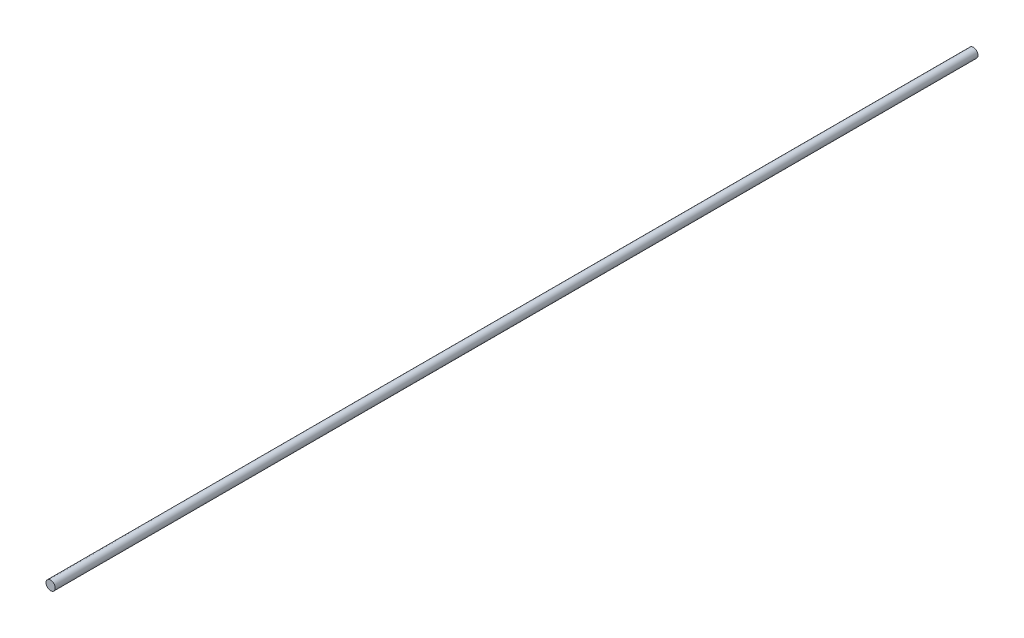
from build123d import *

# Parameters (mm, degrees)
ESQUISSE1_R        = 5
BOSS_EXTRU_1_DEPTH = 1000


with BuildPart() as part:
    # Esquisse1 → Boss.-Extru.1 (new body)
    with BuildSketch(Plane.XY):
        Circle(ESQUISSE1_R)
    extrude(amount=BOSS_EXTRU_1_DEPTH)


solid = part.part
